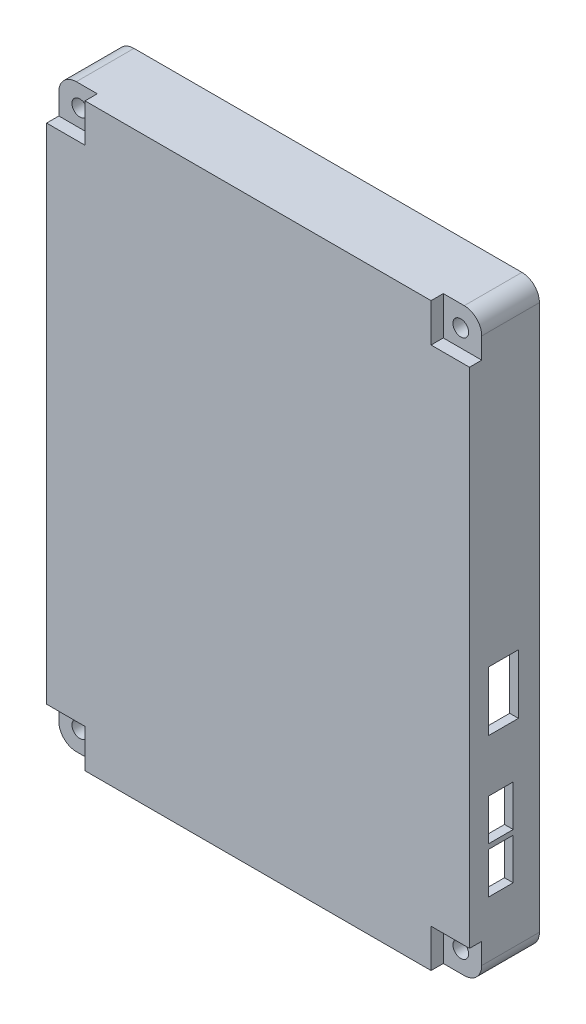
from build123d import *

# Parameters (mm, degrees)
SCHIZZO1_W                   = 121
SCHIZZO1_H                   = 166
ESTRUSIONE_ESTRUSIONE1_DEPTH = 20
RACCORDO1_R                  = 5
TAGLIO_ESTRUSIONE1_DEPTH     = 14.5
SCHIZZO3_R                   = 2.25
TAGLIO_ESTRUSIONE2_DEPTH     = 105.638663982
TAGLIO_ESTRUSIONE3_DEPTH     = 1.5
SCHIZZO5_W                   = 11
SCHIZZO5_H                   = 11
TAGLIO_ESTRUSIONE4_DEPTH     = 3.5
TAGLIO_ESTRUSIONE5_DEPTH     = 3.5
SCHIZZO11_W                  = 8.5
SCHIZZO11_H                  = 17
SCHIZZO11_W_2                = 7
SCHIZZO11_H_2                = 25
TAGLIO_ESTRUSIONE9_DEPTH     = 10
SCHIZZO12_W                  = 16.5
SCHIZZO12_H                  = 73
TAGLIO_ESTRUSIONE10_DEPTH    = 0.5
SCHIZZO13_R                  = 2.5
SCHIZZO13_R_2                = 1.25
SCHIZZO13_R_3                = 1.425
ESTRUSIONE_ESTRUSIONE3_DEPTH = 5
SCHIZZO14_W                  = 8
SCHIZZO14_H                  = 12
TAGLIO_ESTRUSIONE11_DEPTH    = 3
SCHIZZO15_W                  = 4
SCHIZZO15_H                  = 7
TAGLIO_ESTRUSIONE12_DEPTH    = 3
SCHIZZO16_W                  = 4
SCHIZZO16_H                  = 2
ESTRUSIONE_ESTRUSIONE4_DEPTH = 3
SCHIZZO17_W                  = 5
SCHIZZO17_H                  = 9
TAGLIO_ESTRUSIONE13_DEPTH    = 1
SCHIZZO18_W                  = 2.5
SCHIZZO18_H                  = 1.4
ESTRUSIONE_ESTRUSIONE5_DEPTH = 10


with BuildPart() as part:
    # Schizzo1 → Estrusione-Estrusione1 (new body)
    with BuildSketch(Plane.XY):
        Rectangle(SCHIZZO1_W, SCHIZZO1_H)
    extrude(amount=ESTRUSIONE_ESTRUSIONE1_DEPTH)

    # Raccordo1
    raccordo1_edges = [part.edges().sort_by_distance(p)[0] for p in [
        (-60.5, 83, 10),
        (60.5, 83, 10),
        (60.5, -83, 10),
        (-60.5, -83, 10),
    ]]
    fillet(raccordo1_edges, radius=RACCORDO1_R)

    # Schizzo2 → Taglio-Estrusione1 (cut)
    with BuildSketch(Plane(origin=(0, 0, 0), x_dir=(-1, 0, 0), z_dir=(0, 0, -1))):
        Polygon((-51.5, 80), (51.5, 80), (51.5, 74), (57.5, 74), (57.5, -74), (51.5, -74), (51.5, -80), (-51.5, -80), (-51.5, -74), (-57.5, -74), (-57.5, 74), (-51.5, 74), align=None)
    extrude(amount=-TAGLIO_ESTRUSIONE1_DEPTH, mode=Mode.SUBTRACT)

    # Schizzo3 → Taglio-Estrusione2 (cut, through all)
    with BuildSketch(Plane(origin=(0, 0, 0), x_dir=(-1, 0, 0), z_dir=(0, 0, -1))):
        with Locations((-54.5, 77)):
            Circle(SCHIZZO3_R)
        with Locations((54.5, 77)):
            Circle(SCHIZZO3_R)
        with Locations((54.5, -77)):
            Circle(SCHIZZO3_R)
        with Locations((-54.5, -77)):
            Circle(SCHIZZO3_R)
    extrude(amount=-TAGLIO_ESTRUSIONE2_DEPTH, mode=Mode.SUBTRACT)

    # Schizzo4 → Taglio-Estrusione3 (cut)
    with BuildSketch(Plane(origin=(0, 0, 0), x_dir=(-1, 0, 0), z_dir=(0, 0, -1))):
        with BuildLine():
            Line((-55.5, 81.5), (55.5, 81.5))
            ThreePointArc((55.5, 81.5), (57.974873734, 80.474873734), (59, 78))
            Line((59, 78), (59, -78))
            ThreePointArc((59, -78), (57.974873734, -80.474873734), (55.5, -81.5))
            Line((55.5, -81.5), (-55.5, -81.5))
            ThreePointArc((-55.5, -81.5), (-57.974873734, -80.474873734), (-59, -78))
            Line((-59, -78), (-59, 78))
            ThreePointArc((-59, 78), (-57.974873734, 80.474873734), (-55.5, 81.5))
        make_face()
    extrude(amount=-TAGLIO_ESTRUSIONE3_DEPTH, mode=Mode.SUBTRACT)

    # Schizzo5 → Taglio-Estrusione4 (cut)
    with BuildSketch(Plane.XY.offset(20)):
        with Locations((-55, 77.5)):
            Rectangle(SCHIZZO5_W, SCHIZZO5_H)
        with Locations((55, 77.5)):
            Rectangle(SCHIZZO5_W, SCHIZZO5_H)
        with Locations((55, -77.5)):
            Rectangle(SCHIZZO5_W, SCHIZZO5_H)
        with Locations((-55, -77.5)):
            Rectangle(SCHIZZO5_W, SCHIZZO5_H)
    extrude(amount=-TAGLIO_ESTRUSIONE4_DEPTH, mode=Mode.SUBTRACT)

    # Schizzo6 → Taglio-Estrusione5 (cut)
    with BuildSketch(Plane(origin=(0, 0, 14.5), x_dir=(-1, 0, 0), z_dir=(0, 0, -1))):
        Polygon((-57.5, 71), (-48.5, 71), (-48.5, 80), (48.5, 80), (48.5, 71), (57.5, 71), (57.5, -71), (48.5, -71), (48.5, -80), (-48.5, -80), (-48.5, -71), (-57.5, -71), align=None)
    extrude(amount=-TAGLIO_ESTRUSIONE5_DEPTH, mode=Mode.SUBTRACT)

    # Schizzo11 → Taglio-Estrusione9 (cut)
    with BuildSketch(Plane.ZY.offset(-57.5)):
        with Locations((10.25, -13.5)):
            Rectangle(SCHIZZO11_W, SCHIZZO11_H)
        with Locations((11, -49.5)):
            Rectangle(SCHIZZO11_W_2, SCHIZZO11_H_2)
    extrude(amount=-TAGLIO_ESTRUSIONE9_DEPTH, mode=Mode.SUBTRACT)

    # Schizzo12 → Taglio-Estrusione10 (cut)
    with BuildSketch(Plane.ZY.offset(-57.5)):
        with Locations((9.75, -33.5)):
            Rectangle(SCHIZZO12_W, SCHIZZO12_H)
    extrude(amount=-TAGLIO_ESTRUSIONE10_DEPTH, mode=Mode.SUBTRACT)

    # Schizzo13 → Estrusione-Estrusione3 (add)
    # profile 1 of 4: a face of its own
    with BuildSketch(Plane(origin=(0, 0, 18), x_dir=(-1, 0, 0), z_dir=(0, 0, -1))):
        with Locations(Location((54.5, -49.25, 0), (0, 0, 180))):
            Circle(SCHIZZO13_R)
        with Locations((54.5, -49.25)):
            Circle(SCHIZZO13_R_2, mode=Mode.SUBTRACT)
    # profile 2 of 4: a face of its own
    with BuildSketch(Plane(origin=(0, 0, 18), x_dir=(-1, 0, 0), z_dir=(0, 0, -1))):
        with Locations(Location((54.5, -66.75, 0), (0, 0, 180))):
            Circle(SCHIZZO13_R)
        with Locations((54.5, -66.75)):
            Circle(SCHIZZO13_R_2, mode=Mode.SUBTRACT)
    # profile 3 of 4: a face of its own
    with BuildSketch(Plane(origin=(0, 0, 18), x_dir=(-1, 0, 0), z_dir=(0, 0, -1))):
        with Locations(Location((22.8, -64.7, 0), (0, 0, 180))):
            Circle(SCHIZZO13_R)
        with Locations((22.8, -64.7)):
            Circle(SCHIZZO13_R_2, mode=Mode.SUBTRACT)
    # profile 4 of 4: a face of its own
    with BuildSketch(Plane(origin=(0, 0, 18), x_dir=(-1, 0, 0), z_dir=(0, 0, -1))):
        with Locations(Location((22.8, -51.3, 0), (0, 0, 180))):
            Circle(SCHIZZO13_R)
        with Locations((22.8, -51.3)):
            Circle(SCHIZZO13_R_3, mode=Mode.SUBTRACT)
    extrude(amount=ESTRUSIONE_ESTRUSIONE3_DEPTH)

    # Schizzo14 → Taglio-Estrusione11 (cut)
    with BuildSketch(Plane.ZY.offset(60.5)):
        with Locations((10, -58)):
            Rectangle(SCHIZZO14_W, SCHIZZO14_H)
    extrude(amount=-TAGLIO_ESTRUSIONE11_DEPTH, mode=Mode.SUBTRACT)

    # Schizzo15 → Taglio-Estrusione12 (cut)
    with BuildSketch(Plane(origin=(-57.5, 0, 0), x_dir=(0, 0, -1), z_dir=(1, 0, 0))):
        with Locations((-16, 18)):
            Rectangle(SCHIZZO15_W, SCHIZZO15_H)
    extrude(amount=-TAGLIO_ESTRUSIONE12_DEPTH, mode=Mode.SUBTRACT)

    # Schizzo16 → Estrusione-Estrusione4 (add)
    with BuildSketch(Plane(origin=(0, 0, 18), x_dir=(-1, 0, 0), z_dir=(0, 0, -1))):
        with Locations((55.5, 23.8)):
            Rectangle(SCHIZZO16_W, SCHIZZO16_H)
        with Locations((55.5, 12.2)):
            Rectangle(SCHIZZO16_W, SCHIZZO16_H)
    extrude(amount=ESTRUSIONE_ESTRUSIONE4_DEPTH)

    # Schizzo17 → Taglio-Estrusione13 (cut)
    with BuildSketch(Plane.ZY.offset(60.5)):
        with Locations((15.5, 18)):
            Rectangle(SCHIZZO17_W, SCHIZZO17_H)
    extrude(amount=-TAGLIO_ESTRUSIONE13_DEPTH, mode=Mode.SUBTRACT)

    # Schizzo18 → Estrusione-Estrusione5 (add)
    with BuildSketch(Plane(origin=(0, 0, 14.5), x_dir=(-1, 0, 0), z_dir=(0, 0, -1))):
        with Locations((-59.25, -49.5)):
            Rectangle(SCHIZZO18_W, SCHIZZO18_H)
    extrude(amount=ESTRUSIONE_ESTRUSIONE5_DEPTH)


solid = part.part
